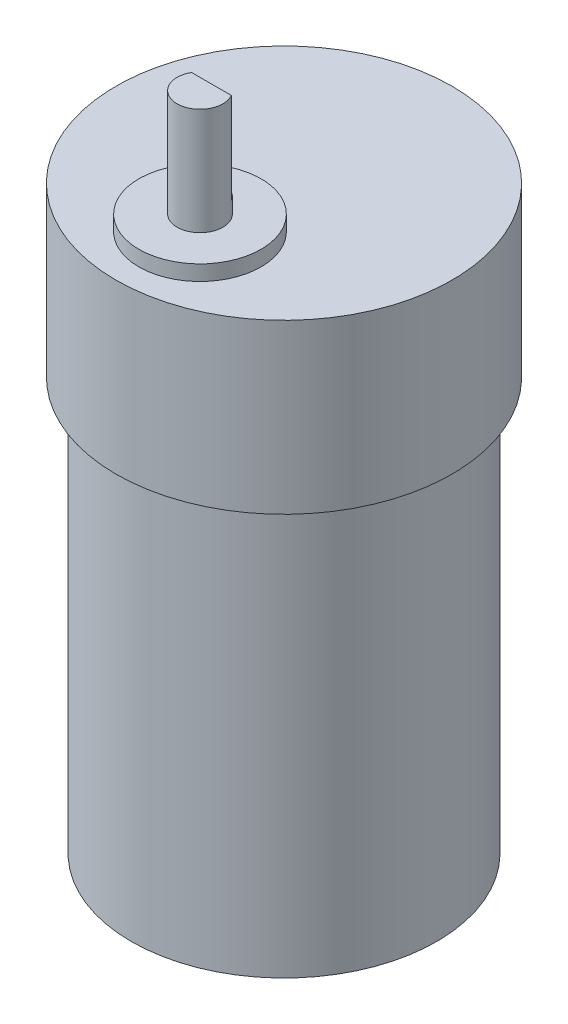
from build123d import *

# Parameters (mm, degrees)
SKETCH1_R           = 15.875
BOSS_EXTRUDE1_DEPTH = 42.8625
SKETCH2_R           = 17.4625
BOSS_EXTRUDE2_DEPTH = 17.4625
SKETCH3_R           = 6.35
BOSS_EXTRUDE3_DEPTH = 1.5875
SKETCH4_R           = 2.38125
BOSS_EXTRUDE4_DEPTH = 11.1125
CUT_EXTRUDE1_START  = -9.525
CUT_EXTRUDE1_DEPTH  = 9.525
SKETCH6_R           = 4.7625
BOSS_EXTRUDE5_DEPTH = 1.5875


with BuildPart() as part:
    # Sketch1 → Boss-Extrude1 (new body)
    with BuildSketch(Plane(origin=(0, 0, 0), x_dir=(1, 0, 0), z_dir=(0, 1, 0))):
        with Locations(Location((0, 0, 0), (0, 0, 270))):
            Circle(SKETCH1_R)
    extrude(amount=BOSS_EXTRUDE1_DEPTH)

    # Sketch2 → Boss-Extrude2 (add)
    with BuildSketch(Plane(origin=(0, 42.8625, 0), x_dir=(1, 0, 0), z_dir=(0, 1, 0))):
        with Locations(Location((0, 0, 0), (0, 0, 270))):
            Circle(SKETCH2_R)
    extrude(amount=BOSS_EXTRUDE2_DEPTH)

    # Sketch3 → Boss-Extrude3 (add)
    with BuildSketch(Plane(origin=(0, 60.325, 0), x_dir=(1, 0, 0), z_dir=(0, 1, 0))):
        with Locations(Location((0, -8.73252, 0), (0, 0, 270))):
            Circle(SKETCH3_R)
    extrude(amount=BOSS_EXTRUDE3_DEPTH)

    # Sketch4 → Boss-Extrude4 (add)
    with BuildSketch(Plane(origin=(0, 61.9125, 0), x_dir=(1, 0, 0), z_dir=(0, 1, 0))):
        with Locations(Location((0, -8.73252, 0), (0, 0, 270))):
            Circle(SKETCH4_R)
    extrude(amount=BOSS_EXTRUDE4_DEPTH)

    # Sketch5 → Cut-Extrude1 (cut)
    with BuildSketch(Plane(origin=(0, 73.025, 0), x_dir=(1, 0, 0), z_dir=(0, 1, 0)).offset(CUT_EXTRUDE1_START)):
        with BuildLine():
            Line((-2.062222993, -7.541895), (2.062222993, -7.541895))
            ThreePointArc((2.062222993, -7.541895), (0, -6.35127), (-2.062222993, -7.541895))
        make_face()
    extrude(amount=CUT_EXTRUDE1_DEPTH, mode=Mode.SUBTRACT)

    # Sketch6 → Boss-Extrude5 (add)
    with BuildSketch(Plane.XZ):
        with Locations(Location((0, 0, 0), (0, 0, 90))):
            Circle(SKETCH6_R)
    extrude(amount=BOSS_EXTRUDE5_DEPTH)


solid = part.part
